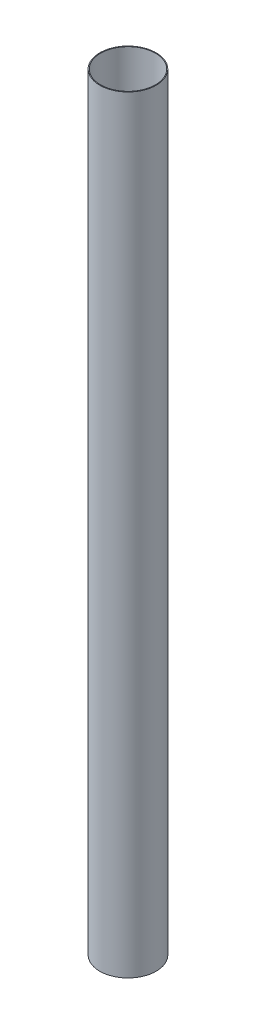
from build123d import *

# Parameters (mm, degrees)
SKETCH2_R           = 78.359
SKETCH2_R_2         = 76.2
BOSS_EXTRUDE1_DEPTH = 2133.6


with BuildPart() as part:
    # Sketch2 → Boss-Extrude1 (new body)
    with BuildSketch(Plane(origin=(0, 0, 0), x_dir=(1, 0, 0), z_dir=(0, 1, 0))):
        with Locations(Location((0, 0, 0), (0, 0, 270))):
            Circle(SKETCH2_R)
        with Locations(Location((0, 0, 0), (0, 0, 270))):
            Circle(SKETCH2_R_2, mode=Mode.SUBTRACT)
    extrude(amount=BOSS_EXTRUDE1_DEPTH)


solid = part.part
